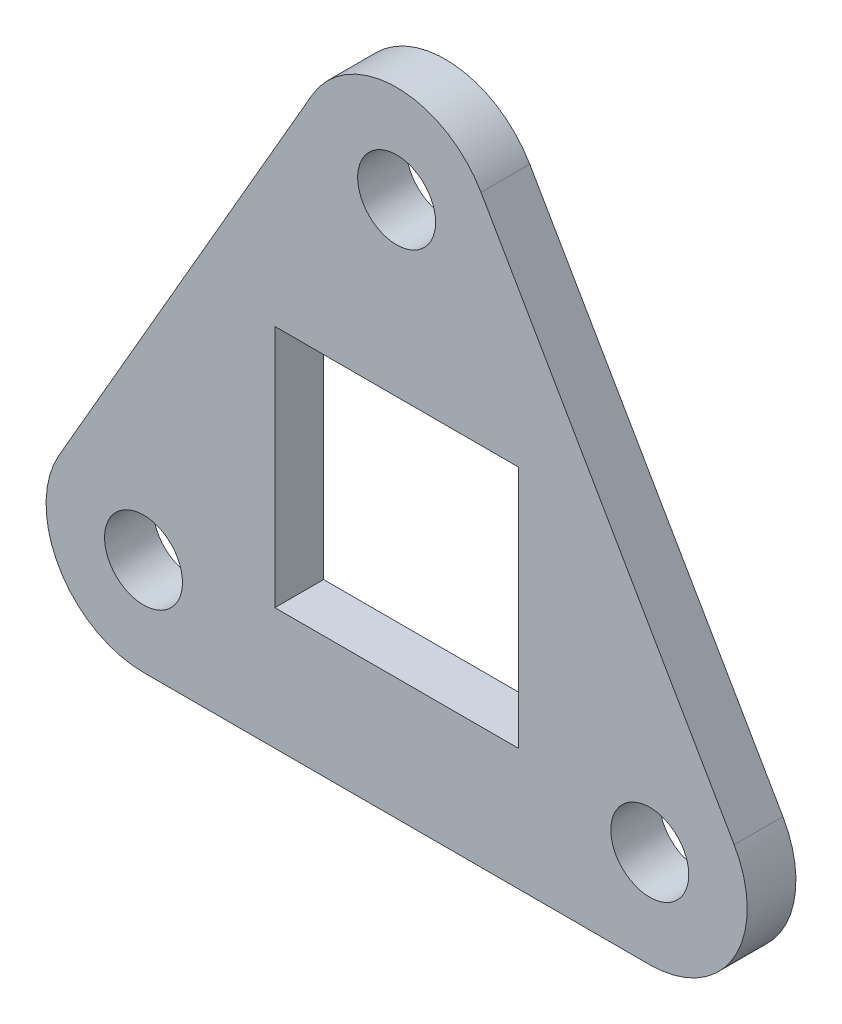
from build123d import *

# Parameters (mm, degrees)
SKETCH_1_R      = 1.6
SKETCH_1_W      = 10
SKETCH_1_H      = 10
EXTRUDE_1_DEPTH = 2


with BuildPart() as part:
    # ｽｹｯﾁ1 → ﾎﾞｽ - 押し出し1 (new body)
    with BuildSketch(Plane.XY):
        with BuildLine():
            Line((-13.856406461, -4), (-3.464101615, 14))
            ThreePointArc((-3.464101615, 14), (0, 16), (3.464101615, 14))
            Line((3.464101615, 14), (13.856406461, -4))
            ThreePointArc((13.856406461, -4), (13.856406461, -8), (10.392304845, -10))
            Line((10.392304845, -10), (-10.392304845, -10))
            ThreePointArc((-10.392304845, -10), (-13.856406461, -8), (-13.856406461, -4))
        make_face()
        with Locations((0, 12)):
            Circle(SKETCH_1_R, mode=Mode.SUBTRACT)
        with Locations((10.392304845, -6)):
            Circle(SKETCH_1_R, mode=Mode.SUBTRACT)
        with Locations((-10.392304845, -6)):
            Circle(SKETCH_1_R, mode=Mode.SUBTRACT)
        Rectangle(SKETCH_1_W, SKETCH_1_H, mode=Mode.SUBTRACT)
    extrude(amount=EXTRUDE_1_DEPTH)


solid = part.part
